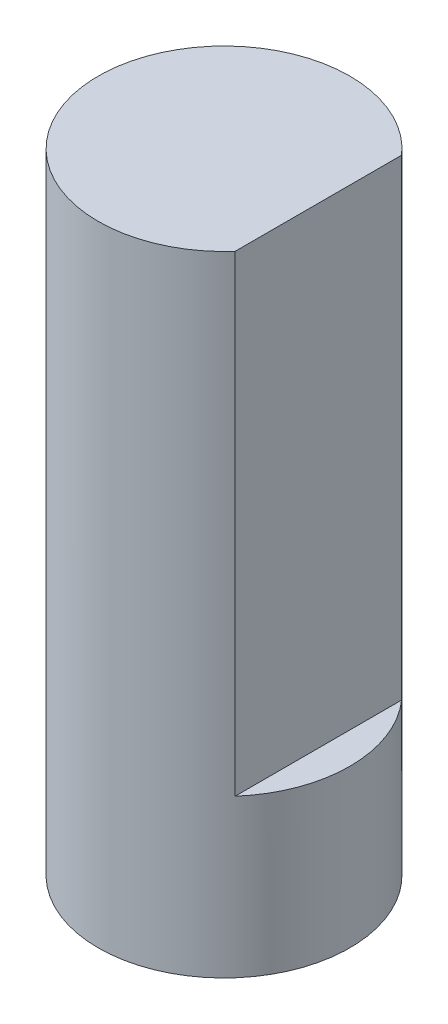
from build123d import *

# Parameters (mm, degrees)
SKETCH1_R           = 4
BOSS_EXTRUDE1_DEPTH = 20
CUT_EXTRUDE1_START  = -15
CUT_EXTRUDE1_DEPTH  = 15


with BuildPart() as part:
    # Sketch1 → Boss-Extrude1 (new body)
    with BuildSketch(Plane(origin=(0, 0, 0), x_dir=(1, 0, 0), z_dir=(0, 1, 0))):
        with Locations(Location((0, 0, 0), (0, 0, 270))):
            Circle(SKETCH1_R)
    extrude(amount=BOSS_EXTRUDE1_DEPTH)

    # Sketch2 → Cut-Extrude1 (cut)
    with BuildSketch(Plane(origin=(0, 20, 0), x_dir=(1, 0, 0), z_dir=(0, 1, 0)).offset(CUT_EXTRUDE1_START)):
        with BuildLine():
            Line((3, 2.645751311), (3, -2.645751311))
            ThreePointArc((3, -2.645751311), (4, 0), (3, 2.645751311))
        make_face()
    extrude(amount=CUT_EXTRUDE1_DEPTH, mode=Mode.SUBTRACT)


solid = part.part
